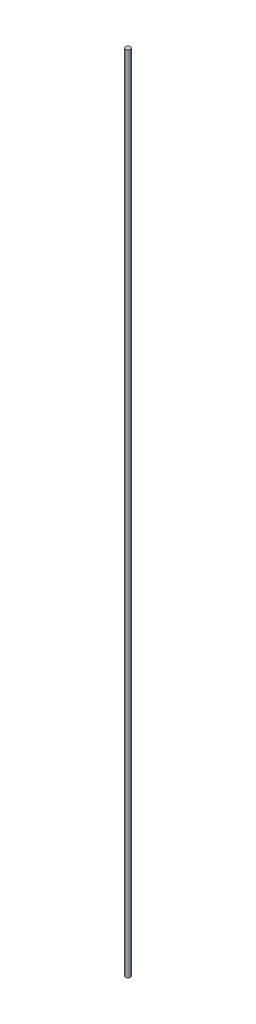
from build123d import *

# Parameters (mm, degrees)
SKETCH1_R           = 0.11
BOSS_EXTRUDE1_DEPTH = 37.57


with BuildPart() as part:
    # Sketch1 → Boss-Extrude1 (new body)
    with BuildSketch(Plane(origin=(0, 0, 0), x_dir=(1, 0, 0), z_dir=(0, 1, 0))):
        with Locations(Location((0, 0, 0), (0, 0, 270))):
            Circle(SKETCH1_R)
    extrude(amount=-BOSS_EXTRUDE1_DEPTH)


solid = part.part
